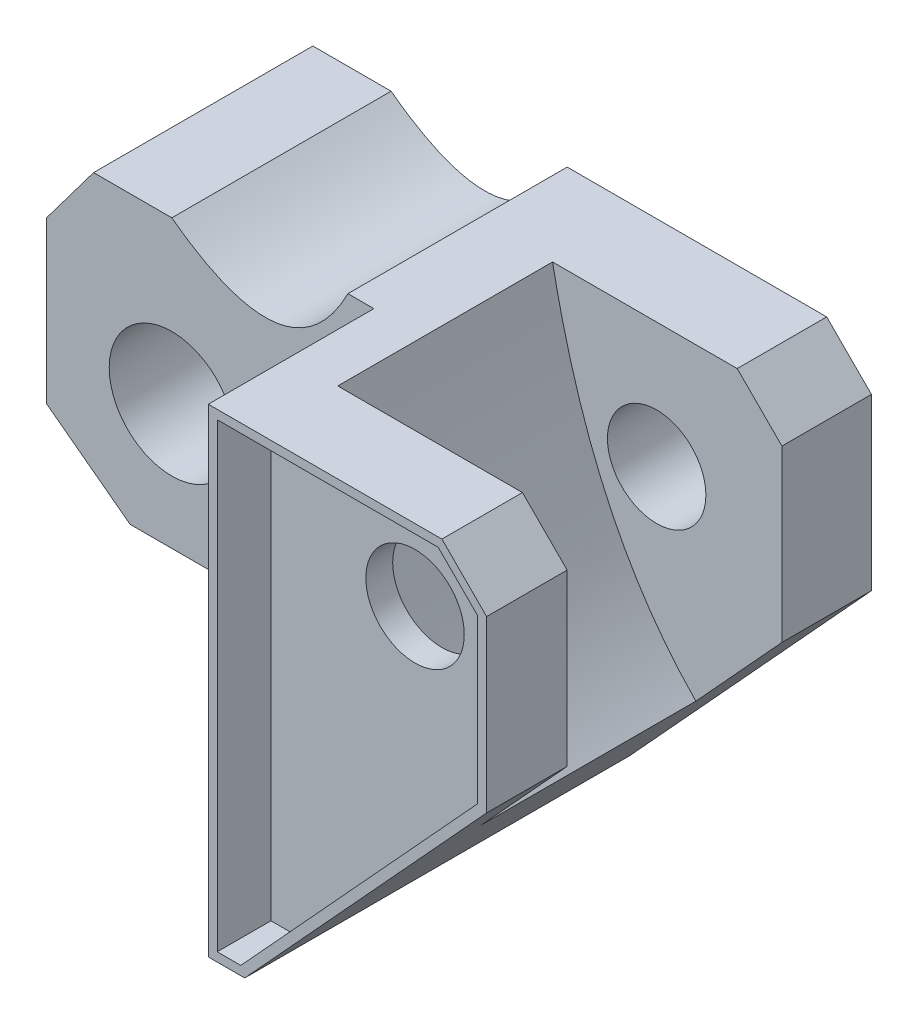
from build123d import *

# Parameters (mm, degrees)
BOSS_EXTRUDE1_DEPTH     = 43
SKETCH2_R               = 7
CUT_EXTRUDE1_DEPTH      = 43
SKETCH3_R               = 5.5
CUT_EXTRUDE2_DEPTH      = 43
CUT_EXTRUDE3_DEPTH      = 81.267405813
CUT_EXTRUDE3_DEPTH_BACK = 81.267405813
SKETCH4_W               = 43.989032816
SKETCH4_H               = 19
SKETCH5_W               = 35.072240015
SKETCH5_H               = 24
CUT_EXTRUDE4_DEPTH      = 43
BOSS_EXTRUDE2_DEPTH     = 24
CUT_EXTRUDE5_DEPTH      = 6


with BuildPart() as part:
    # Sketch1 → Boss-Extrude1 (new body)
    with BuildSketch(Plane.XY):
        with BuildLine():
            Line((0, 0), (-9.330406061, 7))
            Line((-9.330406061, 7), (-9.330406061, 25))
            Line((-9.330406061, 25), (-4.078758954, 32))
            Line((-4.078758954, 32), (4.669593939, 32))
            add(Edge.make_bspline(
                [(4.669593939, 32), (17.970448987, 22.058553501), (24.343418505, 34.49495508)],
                knots=[0, 0, 0, 1, 1, 1], degree=2))
            Line((24.343418505, 34.49495508), (53.343418505, 34.49495508))
            Line((53.343418505, 34.49495508), (58.343418505, 29.49495508))
            Line((58.343418505, 29.49495508), (58.343418505, 10.49495508))
            Line((58.343418505, 10.49495508), (31.309807425, -19))
            Line((31.309807425, -19), (22.799304213, -19))
            Line((22.799304213, -19), (18.70656591, 0))
            Line((18.70656591, 0), (0, 0))
        make_face()
    extrude(amount=BOSS_EXTRUDE1_DEPTH)

    # Sketch2 → Cut-Extrude1 (cut)
    with BuildSketch(Plane(origin=(0, 0, 0), x_dir=(-1, 0, 0), z_dir=(0, 0, -1))):
        with Locations((-4.669593939, 14)):
            Circle(SKETCH2_R)
    extrude(amount=-CUT_EXTRUDE1_DEPTH, mode=Mode.SUBTRACT)

    # Sketch3 → Cut-Extrude2 (cut)
    with BuildSketch(Plane.XY.offset(43)):
        with Locations((44.343418505, 20.49495508)):
            Circle(SKETCH3_R)
    extrude(amount=-CUT_EXTRUDE2_DEPTH, mode=Mode.SUBTRACT)

    # Sketch4 → Cut-Extrude3 (cut, two sides: drawn at the far end of the back side and taken through both)
    with BuildSketch(Plane(origin=(0, 0, 0), x_dir=(1, 0, 0), z_dir=(0, 1, 0)).offset(-CUT_EXTRUDE3_DEPTH_BACK)):
        with Locations((5.245897655, -34.002948031)):
            Rectangle(SKETCH4_W, SKETCH4_H)
    extrude(amount=CUT_EXTRUDE3_DEPTH + CUT_EXTRUDE3_DEPTH_BACK, mode=Mode.SUBTRACT)

    # Sketch5 → Cut-Extrude4 (cut)
    with BuildSketch(Plane(origin=(0, 0, 0), x_dir=(1, 0, 0), z_dir=(0, 1, 0))):
        with Locations((50.243902929, -22)):
            Rectangle(SKETCH5_W, SKETCH5_H)
    extrude(amount=CUT_EXTRUDE4_DEPTH, mode=Mode.SUBTRACT)

    # Sketch6 → Boss-Extrude2 (add)
    with BuildSketch(Plane.XY.offset(10)):
        with BuildLine():
            Line((32.707782921, 34.49495508), (32.707782921, 0))
            Line((32.707782921, 0), (48.724263868, 0))
            add(Edge.make_bspline(
                [(48.724263868, 0), (39.533647592, 9.345830828), (35.169336989, 21.979196109), (32.707782921, 34.49495508)],
                knots=[0, 0, 0, 0, 1, 1, 1, 1], degree=3))
        make_face()
    extrude(amount=BOSS_EXTRUDE2_DEPTH)

    # 3DSketch1 → Cut-Extrude5 (cut)
    with BuildSketch(Plane(origin=(30.869867984, -18, 43), x_dir=(0.39376955076248915, 0.9192091932157269, 0), z_dir=(0, 0, 1))):
        Polygon((0, 0), (36.9748267, -12.961129751), (53.701528522, -5.795768579), (56.020931318, 0), (46.299237224, 22.694163546), (-1.035398889, 2.417018217), align=None)
    extrude(amount=-CUT_EXTRUDE5_DEPTH, mode=Mode.SUBTRACT)


solid = part.part
